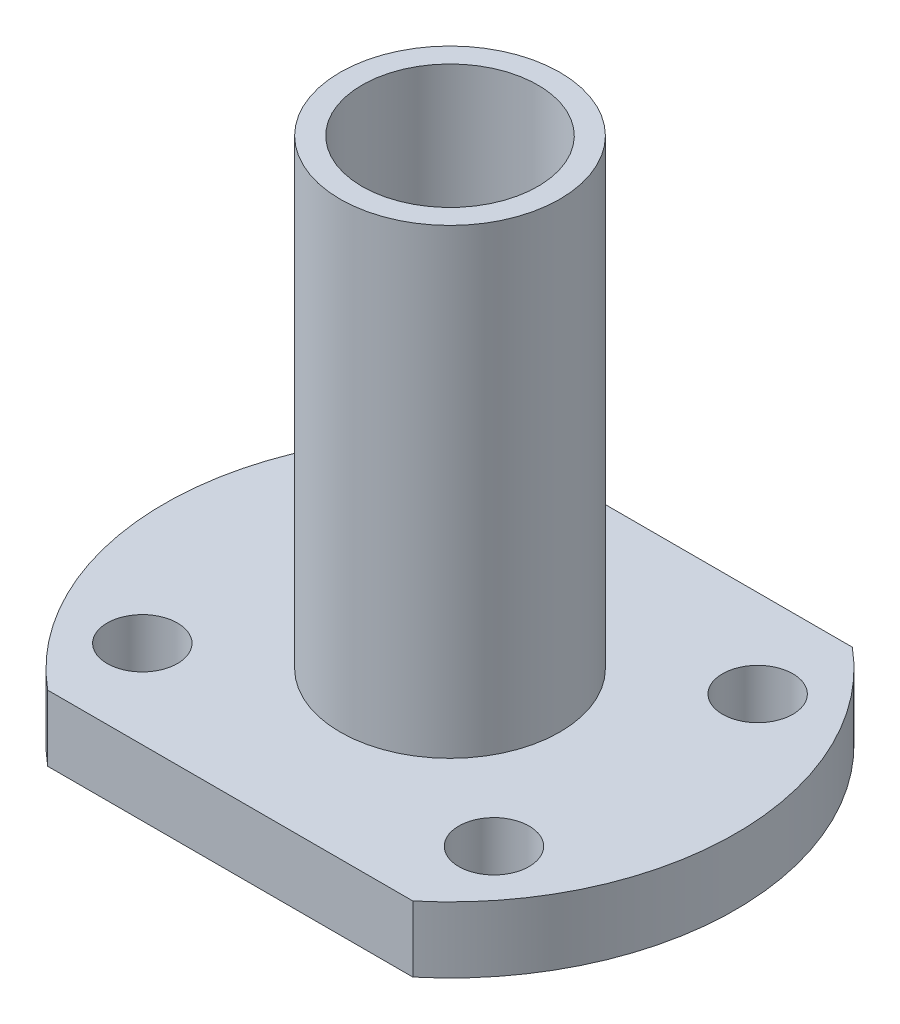
from build123d import *

# Parameters (mm, degrees)
SKETCH1_R                  = 5
BOSS_EXTRUDE1_DEPTH        = 24
BOSS_EXTRUDE2_DEPTH        = 3
SKETCH3_R                  = 4
CUT_EXTRUDE1_DEPTH         = 30.068883707
F_3_2_3_2_DIAMETER_HOLE1_D = 3.2


with BuildPart() as part:
    # Sketch1 → Boss-Extrude1 (new body)
    with BuildSketch(Plane(origin=(0, 0, 0), x_dir=(1, 0, 0), z_dir=(0, 1, 0))):
        with Locations(Location((0, 0, 0), (0, 0, 270))):
            Circle(SKETCH1_R)
    extrude(amount=BOSS_EXTRUDE1_DEPTH)

    # Sketch2 → Boss-Extrude2 (add)
    with BuildSketch(Plane(origin=(0, 0, 0), x_dir=(1, 0, 0), z_dir=(0, 1, 0))):
        with BuildLine():
            Line((8.306623863, 10), (-8.306623863, 10))
            ThreePointArc((-8.306623863, 10), (-11.768307238, 5.523309222), (-13, -2.7e-08))
            ThreePointArc((-13, -2.7e-08), (-11.768307226, -5.523309246), (-8.306623863, -10))
            Line((-8.306623863, -10), (8.306623863, -10))
            ThreePointArc((8.306623863, -10), (11.768307232, -5.523309234), (13, 0))
            ThreePointArc((13, 0), (11.768307232, 5.523309234), (8.306623863, 10))
        make_face()
    extrude(amount=BOSS_EXTRUDE2_DEPTH)

    # Sketch3 → Cut-Extrude1 (cut, through all)
    with BuildSketch(Plane(origin=(0, 24, 0), x_dir=(1, 0, 0), z_dir=(0, 1, 0))):
        with Locations(Location((0, 0, 0), (0, 0, 270))):
            Circle(SKETCH3_R)
    extrude(amount=-CUT_EXTRUDE1_DEPTH, mode=Mode.SUBTRACT)

    # Ø3.2 (3.2) Diameter Hole1 (through all)
    with Locations(Plane(origin=(8, 3, 6), x_dir=(0, 0, 1), z_dir=(0, 1, 0))):
        with Locations((0, 0), (-12, 0), (-12, -16), (0, -16)):
            Hole(F_3_2_3_2_DIAMETER_HOLE1_D / 2)


solid = part.part
